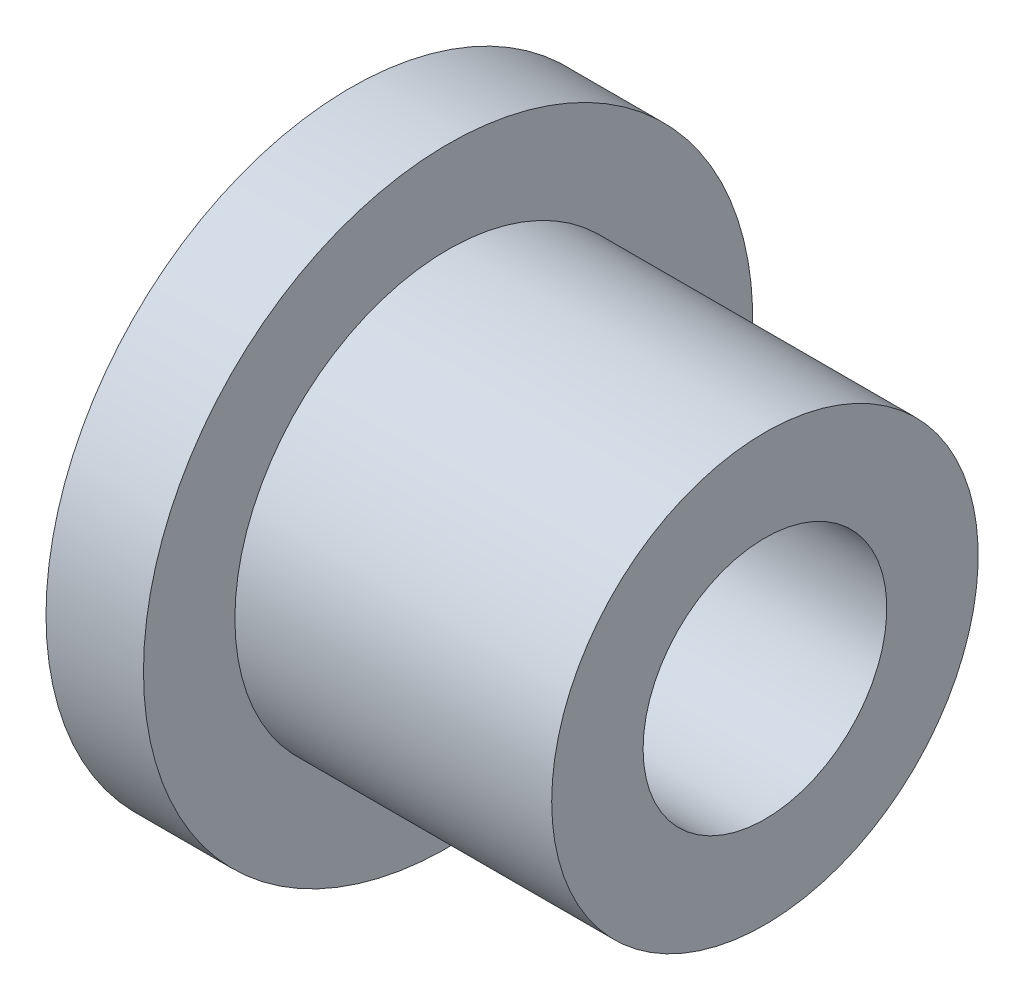
from build123d import *


with BuildPart() as part:
    # Sketch1 → Revolve1 (revolve)
    with BuildSketch(Plane.XY, mode=Mode.PRIVATE) as revolve1_sk:
        Polygon((2.124699355, 5.632077568), (-31.875300645, 5.632077568), (-31.875300645, 20.632077568), (-23.875300645, 20.632077568), (-23.875300645, 13.132077568), (2.124699355, 13.132077568), align=None)
    revolve(revolve1_sk.sketch.rotate(Axis((-24.916116972, -4.367922432, 0), (1, 0, 0)), 90), axis=Axis((-24.916116972, -4.367922432, 0), (1, 0, 0)))


solid = part.part
